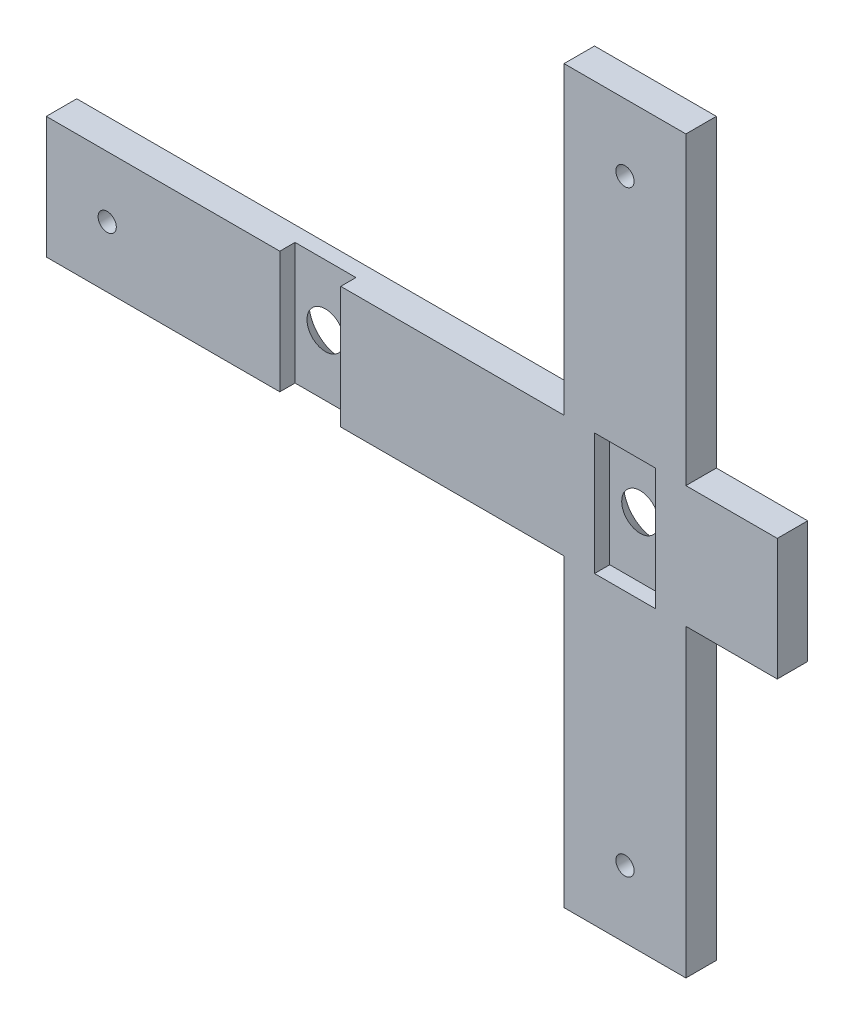
from build123d import *

# Parameters (mm, degrees)
SKETCH1_W                  = 152.4
SKETCH1_H                  = 152.4
EXTRUDE1_DEPTH             = 6.35
SKETCH3_OUTSIDE_W          = 197.524
SKETCH3_OUTSIDE_H          = 197.524
EXTRUDE3_DEPTH             = 108.95
F_10_24_TAPPED_HOLE2_D     = 3.7973
F_10_24_TAPPED_HOLE2_DEPTH = 14.986
F_10_24_TAPPED_HOLE2_TIP   = 1.140824014
EXTRUDE4_DEPTH             = 3.175
SKETCH20_W                 = 12.7
SKETCH20_H                 = 25.4
EXTRUDE5_DEPTH             = 3.175


with BuildPart() as part:
    # Sketch1 → Extrude1 (new body)
    with BuildSketch(Plane.XY):
        Rectangle(SKETCH1_W, SKETCH1_H)
    extrude(amount=EXTRUDE1_DEPTH)

    # Sketch3 outside → Extrude3 (cut, through all)
    with BuildSketch(Plane.XY.offset(6.35)):
        Rectangle(SKETCH3_OUTSIDE_W, SKETCH3_OUTSIDE_H)
        Polygon((57.15, 76.2), (57.15, 12.7), (76.2, 12.7), (76.2, -12.7), (57.15, -12.7), (57.15, -76.2), (31.75, -76.2), (31.75, -12.7), (-76.2, -12.7), (-76.2, 12.7), (31.75, 12.7), (31.75, 76.2), align=None, mode=Mode.SUBTRACT)
    extrude(amount=-EXTRUDE3_DEPTH, mode=Mode.SUBTRACT)

    # Sketch11 → CSK for 1/4 Flat Head Socket Cap Screw2 (revolve, cut)
    with BuildSketch(Plane(origin=(-21.16074, -8.054e-06, 0), x_dir=(0, 1, 0), z_dir=(1, 0, 0))):
        Polygon((0, 0), (0, 6.35), (3.3782, 6.35), (3.3782, 3.728390023), (6.61924, 0), align=None)
    revolve(axis=Axis((-21.16074, -8.054e-06, -6.35), (0, 0, 1)), mode=Mode.SUBTRACT)

    # Sketch13 → CSK for 1/4 Flat Head Socket Cap Screw3 (revolve, cut)
    with BuildSketch(Plane(origin=(44.45, -8.054e-06, 0), x_dir=(0, 1, 0), z_dir=(1, 0, 0))):
        Polygon((0, 0), (0, 6.35), (3.3782, 6.35), (3.3782, 3.728390023), (6.61924, 0), align=None)
    revolve(axis=Axis((44.45, -8.054e-06, -6.35), (0, 0, 1)), mode=Mode.SUBTRACT)

    # #10-24 Tapped Hole2
    with Locations(Plane(origin=(-63.5, 0, 0), x_dir=(-1, 0, 0), z_dir=(0, 0, -1))):
        with Locations((0, 0), (-107.95, 62.23), (-107.95, -62.23)):
            Hole(F_10_24_TAPPED_HOLE2_D / 2, depth=F_10_24_TAPPED_HOLE2_DEPTH)
            with Locations((0, 0, -(F_10_24_TAPPED_HOLE2_DEPTH + F_10_24_TAPPED_HOLE2_TIP / 2))):  # 118° drill point
                Cone(0, F_10_24_TAPPED_HOLE2_D / 2, F_10_24_TAPPED_HOLE2_TIP, mode=Mode.SUBTRACT)

    # Sketch18 → Extrude4 (cut)
    with BuildSketch(Plane.XY.offset(6.35)):
        Polygon((-27.51074, 12.7), (-27.51074, -12.702586498), (-14.81074, -12.7), (-14.81074, 12.7), align=None)
    extrude(amount=-EXTRUDE4_DEPTH, mode=Mode.SUBTRACT)

    # Sketch20 → Extrude5 (cut)
    with BuildSketch(Plane.XY.offset(6.35)):
        with Locations((44.45, 0)):
            Rectangle(SKETCH20_W, SKETCH20_H)
    extrude(amount=-EXTRUDE5_DEPTH, mode=Mode.SUBTRACT)


solid = part.part
